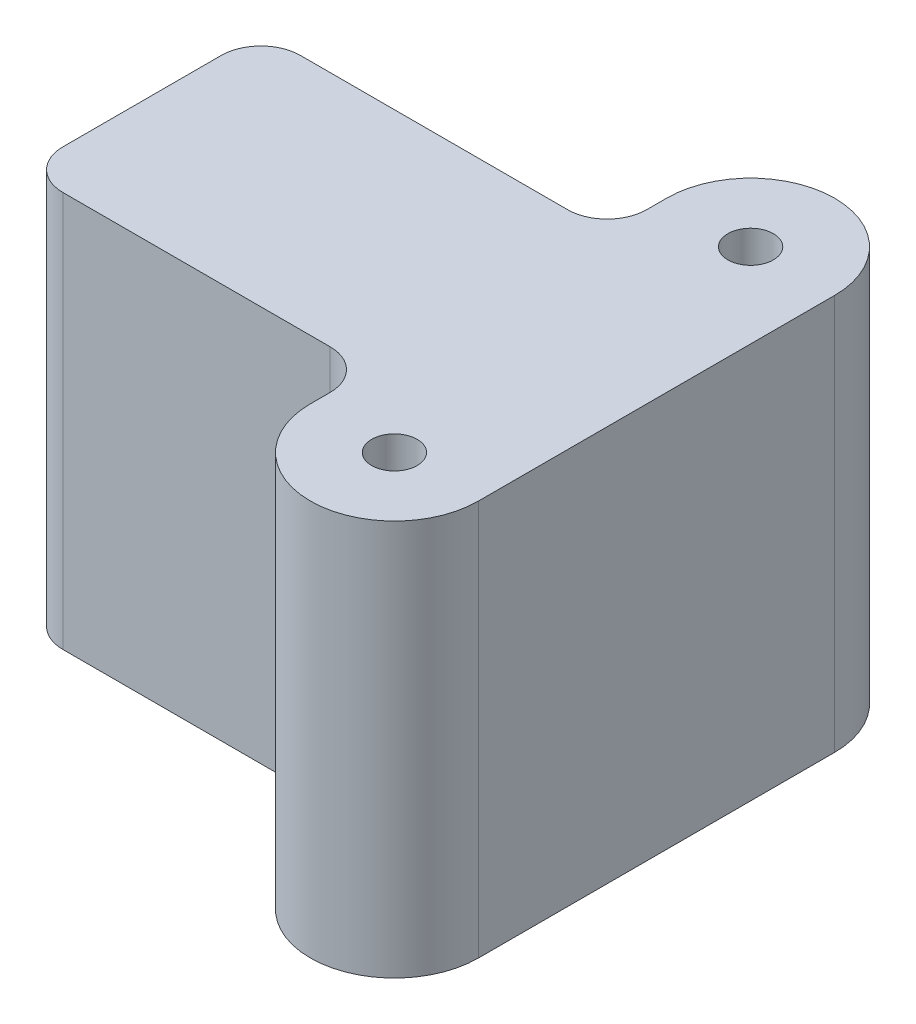
from build123d import *

# Parameters (mm, degrees)
ESBO_O1_R                = 1.15
RESSALTO_EXTRUS_O1_DEPTH = 20
FILETE1_R                = 2


with BuildPart() as part:
    # Esboço1 → Ressalto-extrusão1 (new body)
    with BuildSketch(Plane(origin=(0, 0, 0), x_dir=(1, 0, 0), z_dir=(0, 1, 0))):
        with BuildLine():
            Line((-8.5, 9), (-8.5, 6))
            Line((-8.5, 6), (-26, 6))
            Line((-26, 6), (-26, -6))
            Line((-26, -6), (-8.5, -6))
            Line((-8.5, -6), (-8.5, -9))
            ThreePointArc((-8.5, -9), (-4.25, -13.25), (0, -9))
            Line((0, -9), (0, 9))
            ThreePointArc((0, 9), (-4.25, 13.25), (-8.5, 9))
        make_face()
        with Locations(Location((-4.25, 9, 0), (0, 0, 270))):
            Circle(ESBO_O1_R, mode=Mode.SUBTRACT)
        with Locations(Location((-4.25, -9, 0), (0, 0, 270))):
            Circle(ESBO_O1_R, mode=Mode.SUBTRACT)
    extrude(amount=RESSALTO_EXTRUS_O1_DEPTH)

    # Filete1
    filete1_edges = [part.edges().sort_by_distance(p)[0] for p in [
        (-8.5, 10, 6),
        (-26, 10, 6),
        (-26, 10, -6),
        (-8.5, 10, -6),
    ]]
    fillet(filete1_edges, radius=FILETE1_R)


solid = part.part
